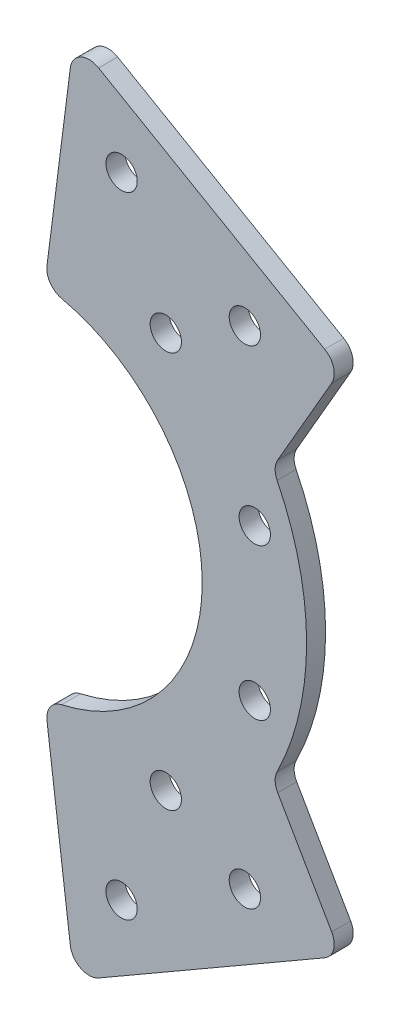
from build123d import *

# Parameters (mm, degrees)
SKETCH1_R           = 3.3
BOSS_EXTRUDE1_DEPTH = 4


with BuildPart() as part:
    # Sketch1 → Boss-Extrude1 (new body)
    with BuildSketch(Plane.XY):
        with BuildLine():
            Line((5.288922953, 41.473211764), (10.211865104, 80.076576605))
            ThreePointArc((10.211865104, 80.076576605), (12.403300333, 83.154463495), (16.179730642, 83.034671229))
            Line((16.179730642, 83.034671229), (63.820269358, 55.529393377))
            ThreePointArc((63.820269358, 55.529393377), (65.683972663, 53.100567942), (65.284370973, 50.065291762))
            Line((65.284370973, 50.065291762), (53.908491826, 30.361691097))
            ThreePointArc((53.908491826, 30.361691097), (53.374672591, 28.490644117), (53.786806351, 26.589085404))
            ThreePointArc((53.786806351, 26.589085404), (60, 0), (53.786806351, -26.589085404))
            ThreePointArc((53.786806351, -26.589085404), (53.374672591, -28.490644117), (53.908491826, -30.361691097))
            Line((53.908491826, -30.361691097), (65.284370973, -50.065291762))
            ThreePointArc((65.284370973, -50.065291762), (65.683972663, -53.100567942), (63.820269358, -55.529393377))
            Line((63.820269358, -55.529393377), (16.179730642, -83.034671229))
            ThreePointArc((16.179730642, -83.034671229), (12.403300333, -83.154463495), (10.211865104, -80.076576605))
            Line((10.211865104, -80.076576605), (5.288922953, -41.473211764))
            ThreePointArc((5.288922953, -41.473211764), (5.980180313, -38.672899027), (8.375189586, -37.065566222))
            ThreePointArc((8.375189586, -37.065566222), (38, 0), (8.375189586, 37.065566222))
            ThreePointArc((8.375189586, 37.065566222), (5.980180313, 38.672899027), (5.288922953, 41.473211764))
        make_face()
        with Locations((30.329719018, 41.74527691)):
            Circle(SKETCH1_R, mode=Mode.SUBTRACT)
        with Locations((49.074516241, 15.94527691)):
            Circle(SKETCH1_R, mode=Mode.SUBTRACT)
        with Locations((49.074516241, -15.94527691)):
            Circle(SKETCH1_R, mode=Mode.SUBTRACT)
        with Locations((30.329719018, -41.74527691)):
            Circle(SKETCH1_R, mode=Mode.SUBTRACT)
        with Locations((21.009618943, 66.389727457)):
            Circle(SKETCH1_R, mode=Mode.SUBTRACT)
        with Locations((46.990381057, 51.389727457)):
            Circle(SKETCH1_R, mode=Mode.SUBTRACT)
        with Locations(Location((46.990381057, -51.389727457, 0), (0, 0, 180))):
            Circle(SKETCH1_R, mode=Mode.SUBTRACT)
        with Locations(Location((21.009618943, -66.389727457, 0), (0, 0, 180))):
            Circle(SKETCH1_R, mode=Mode.SUBTRACT)
    extrude(amount=BOSS_EXTRUDE1_DEPTH)


solid = part.part
